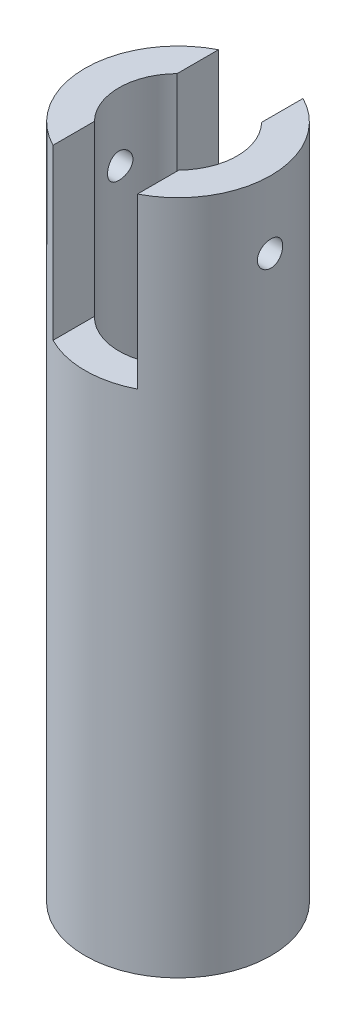
from build123d import *

# Parameters (mm, degrees)
SKETCH1_R           = 5.5
SKETCH1_R_2         = 3.5
BOSS_EXTRUDE1_DEPTH = 40
SKETCH2_W           = 5
SKETCH2_H           = 10
CUT_EXTRUDE1_DEPTH  = 20
SKETCH3_R           = 0.75
CUT_EXTRUDE2_DEPTH  = 10


with BuildPart() as part:
    # Sketch1 → Boss-Extrude1 (new body)
    with BuildSketch(Plane(origin=(0, 0, 0), x_dir=(1, 0, 0), z_dir=(0, 1, 0))):
        with Locations(Location((0, 0, 0), (0, 0, 270))):
            Circle(SKETCH1_R)
        with Locations(Location((0, 0, 0), (0, 0, 270))):
            Circle(SKETCH1_R_2, mode=Mode.SUBTRACT)
    extrude(amount=BOSS_EXTRUDE1_DEPTH)

    # Sketch2 → Cut-Extrude1 (cut, symmetric)
    with BuildSketch(Plane.XY):
        with Locations((0, 35)):
            Rectangle(SKETCH2_W, SKETCH2_H)
        with Locations((0, 45)):
            Rectangle(SKETCH2_W, SKETCH2_H)
    extrude(amount=CUT_EXTRUDE1_DEPTH, both=True, mode=Mode.SUBTRACT)

    # Sketch3 → Cut-Extrude2 (cut, symmetric)
    with BuildSketch(Plane(origin=(0, 0, 0), x_dir=(0, 0, -1), z_dir=(1, 0, 0))):
        with Locations(Location((0, 36, 0), (0, 0, 180))):
            Circle(SKETCH3_R)
    extrude(amount=CUT_EXTRUDE2_DEPTH, both=True, mode=Mode.SUBTRACT)


solid = part.part
